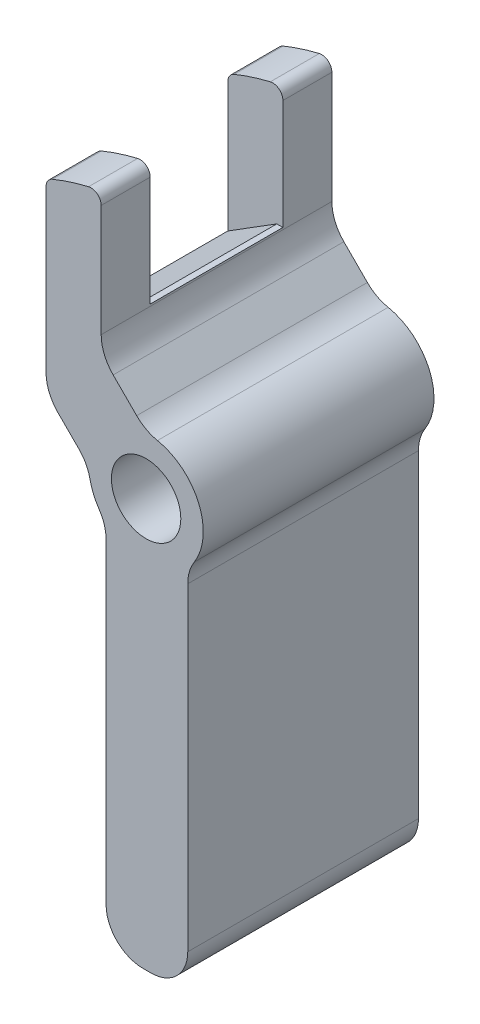
from build123d import *

# Parameters (mm, degrees)
SKETCH1_R           = 1.7
BOSS_EXTRUDE1_DEPTH = 11.3
CUT_EXTRUDE1_REACH  = 28.872
SKETCH2_W           = 6.5
SKETCH2_H           = 6
CHAMFER1_SIZE       = 1.5
CHAMFER1_SIZE2      = 2.400501794
FILLET1_R           = 0.5


with BuildPart() as part:
    # Sketch1 → Boss-Extrude1 (new body)
    with BuildSketch(Plane.XY):
        with BuildLine():
            Line((2.74010383, 9.194695421), (2.74010383, -6.292071669))
            ThreePointArc((2.74010383, -6.292071669), (3.267311624, -7.564863875), (4.54010383, -8.092071669))
            Line((4.54010383, -8.092071669), (4.94010383, -8.092071669))
            ThreePointArc((4.94010383, -8.092071669), (6.212896036, -7.564863875), (6.74010383, -6.292071669))
            Line((6.74010383, -6.292071669), (6.74010383, 9.316577037))
            ThreePointArc((6.74010383, 9.316577037), (6.820858296, 9.879157325), (7.056600411, 10.396306743))
            ThreePointArc((7.056600411, 10.396306743), (7.278226145, 12.999340422), (5.255181103, 14.652274498))
            ThreePointArc((5.255181103, 14.652274498), (4.706198335, 14.850267069), (4.237742883, 15.198308197))
            Line((4.237742883, 15.198308197), (3.085482062, 16.350569018))
            ThreePointArc((3.085482062, 16.350569018), (2.651936559, 16.999415716), (2.499695624, 17.764782581))
            Line((2.499695624, 17.764782581), (2.499695624, 23.862962388))
            ThreePointArc((2.499695624, 23.862962388), (1.125485543, 23.526356004), (-0.200304376, 23.032353678))
            Line((-0.200304376, 23.032353678), (-0.200304376, 14.807928331))
            ThreePointArc((-0.200304376, 14.807928331), (-0.048063441, 14.042561466), (0.385482062, 13.393714769))
            Line((0.385482062, 13.393714769), (1.409315758, 12.369881073))
            ThreePointArc((1.409315758, 12.369881073), (1.757356887, 11.901425621), (1.955349457, 11.352442852))
            ThreePointArc((1.955349457, 11.352442852), (2.120974174, 10.816967431), (2.389933744, 10.325209134))
            ThreePointArc((2.389933744, 10.325209134), (2.650556633, 9.786447131), (2.74010383, 9.194695421))
        make_face()
        with Locations((4.699695624, 11.907928331)):
            Circle(SKETCH1_R, mode=Mode.SUBTRACT)
    extrude(amount=BOSS_EXTRUDE1_DEPTH)

    # Sketch2 → Cut-Extrude1 (cut, up to next)
    with BuildSketch(Plane(origin=(2.499695624, 0, 0), x_dir=(0, 0, -1), z_dir=(1, 0, 0)), mode=Mode.PRIVATE) as cut_extrude1_sk1:
        with Locations((-5.65, 20.862962388)):
            Rectangle(SKETCH2_W, SKETCH2_H)
    cut_extrude1_tool1 = extrude(cut_extrude1_sk1.sketch, amount=-CUT_EXTRUDE1_REACH, mode=Mode.PRIVATE) & part.part
    add(cut_extrude1_tool1.solids().sort_by_distance((2.499696, 20.862962, 5.65))[0], mode=Mode.SUBTRACT)

    # Chamfer1
    chamfer1_edges = [part.edges().sort_by_distance(p)[0] for p in [
        (-0.200304376, 17.862962388, 5.65),
    ]]
    chamfer1_side = [part.faces().sort_by_distance(p)[0] for p in [
        (-0.200304376, 18.920141005, 0.139760929),
    ]]
    chamfer(chamfer1_edges, length=CHAMFER1_SIZE, length2=CHAMFER1_SIZE2, reference=chamfer1_side[0])

    # Fillet1
    fillet1_edges = [part.edges().sort_by_distance(p)[0] for p in [
        (2.499695624, 23.862962388, 10.1),
        (-0.200304376, 23.032353678, 10.1),
        (2.499695624, 23.862962388, 1.2),
        (-0.200304376, 23.032353678, 1.2),
    ]]
    fillet(fillet1_edges, radius=FILLET1_R)


solid = part.part
